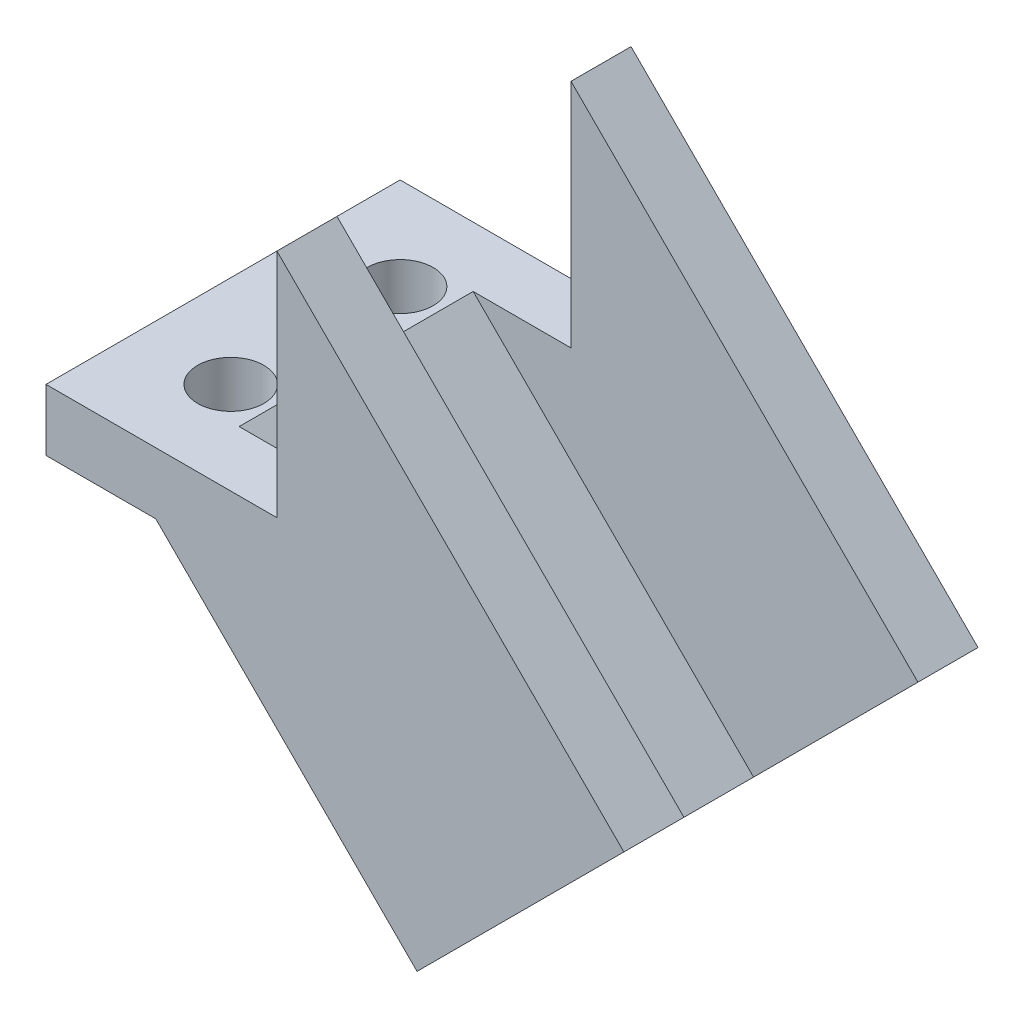
from build123d import *

# Parameters (mm, degrees)
EXTRUDE_1_DEPTH          = 4
EXTRUDE_1_DEPTH_BACK     = 19
SKETCH_2_W               = 15.2
SKETCH_2_H               = 15.221861726
CUT_EXTRUDE_1_DEPTH      = 67
CUT_EXTRUDE_2_DEPTH      = 67
CUT_EXTRUDE_2_DEPTH_BACK = 67
SKETCH_3_R               = 2.15
SKETCH_4_R               = 4
CUT_EXTRUDE_3_DEPTH      = 67
SKETCH_5_R               = 2.15
CUT_EXTRUDE_4_DEPTH      = 67


with BuildPart() as part:
    # 草图1 → 凸台-拉伸1 (new, two sides: drawn at the far end of the back side and taken through both)
    with BuildSketch(Plane.XY.offset(-EXTRUDE_1_DEPTH_BACK)):
        Polygon((-23, 312.827661494), (-23, 297.827661494), (-38, 297.827661494), (-38, 293.827661494), (-30.870057685, 293.827661494), (-13.899494937, 276.857098745), (-11.071067812, 279.68552587), (-0.464466094, 290.292127588), align=None)
    extrude(amount=EXTRUDE_1_DEPTH + EXTRUDE_1_DEPTH_BACK)

    # 草图2 → 切除-拉伸1 (cut)
    with BuildSketch(Plane(origin=(-145.378296841, 145.378296841, 0), x_dir=(0, 0, -1), z_dir=(0.7071067811865483, -0.7071067811865468, 0))):
        with Locations((7.5, 197.450035681)):
            Rectangle(SKETCH_2_W, SKETCH_2_H)
    extrude(amount=-CUT_EXTRUDE_1_DEPTH, mode=Mode.SUBTRACT)

    # 草图3 → 切除-拉伸2 (cut, two sides: drawn at the far end of the back side and taken through both)
    with BuildSketch(Plane.XZ.offset(-293.827661494).offset(-CUT_EXTRUDE_2_DEPTH_BACK)):
        with Locations((-32, -2)):
            Circle(SKETCH_3_R)
        with Locations((-32, -13)):
            Circle(SKETCH_3_R)
    extrude(amount=CUT_EXTRUDE_2_DEPTH + CUT_EXTRUDE_2_DEPTH_BACK, mode=Mode.SUBTRACT)

    # 草图4 → 切除-拉伸3 (cut)
    with BuildSketch(Plane.XZ.offset(-293.827661494)):
        with Locations((-32, -2)):
            Circle(SKETCH_4_R)
        with Locations((-32, -13)):
            Circle(SKETCH_4_R)
    extrude(amount=CUT_EXTRUDE_3_DEPTH, mode=Mode.SUBTRACT)

    # 草图5 → 切除-拉伸4 (cut)
    with BuildSketch(Plane(origin=(131.478801904, 131.478801904, 0), x_dir=(0, 0, 1), z_dir=(-0.7071067811865472, -0.7071067811865478, 0))):
        with Locations((-7.5, 213.595959067)):
            Circle(SKETCH_5_R)
    extrude(amount=-CUT_EXTRUDE_4_DEPTH, mode=Mode.SUBTRACT)


solid = part.part
